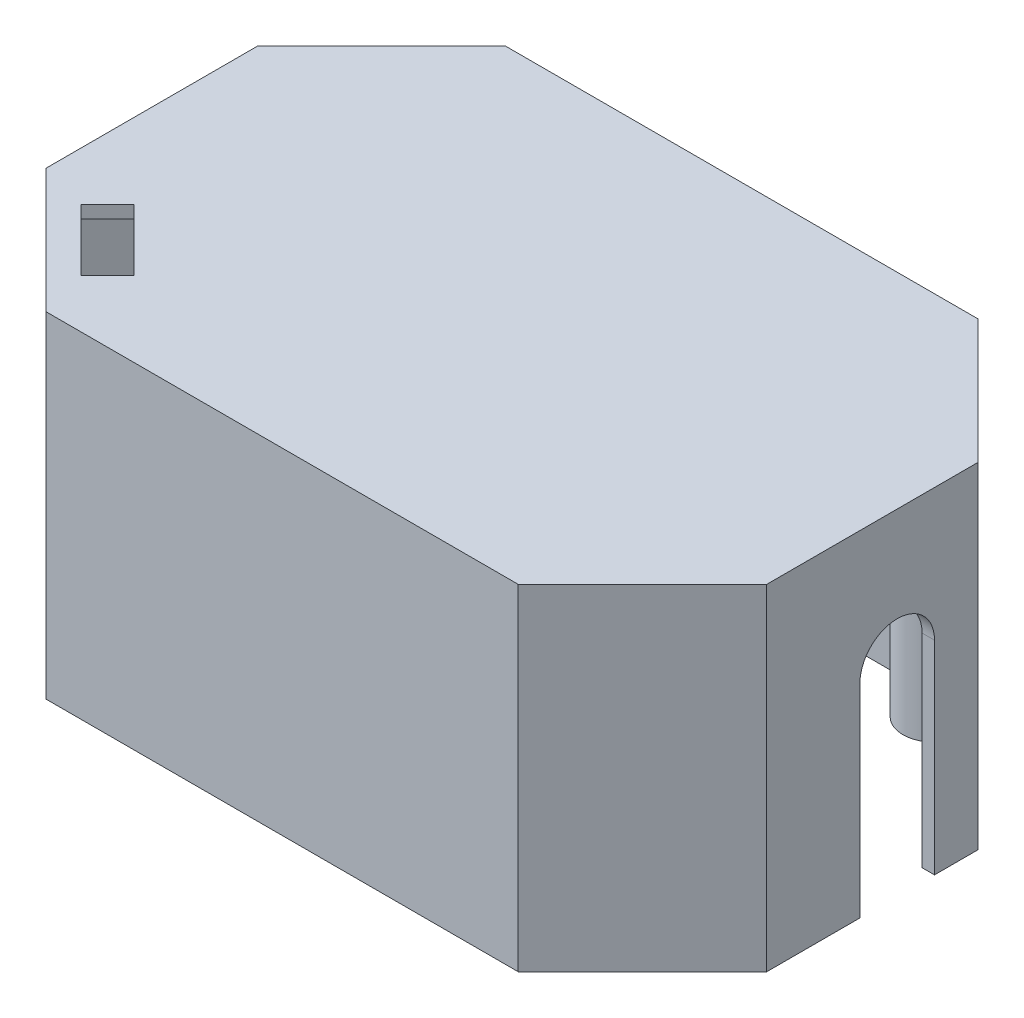
from build123d import *

# Parameters (mm, degrees)
BOSS_EXTRUDE1_DEPTH = 52
BOSS_EXTRUDE2_DEPTH = 2
SKETCH3_R           = 5
BOSS_EXTRUDE3_DEPTH = 52
SKETCH4_R           = 2.5
CUT_EXTRUDE1_DEPTH  = 15
CUT_EXTRUDE2_DEPTH  = 15
CUT_EXTRUDE3_REACH  = 136.539


with BuildPart() as part:
    # Sketch1 → Boss-Extrude1 (new body)
    with BuildSketch(Plane(origin=(0, 0, 0), x_dir=(1, 0, 0), z_dir=(0, 1, 0))):
        Polygon((38, -32.421617333), (-38, -32.421617333), (-58, -12.421649809), (-58, 21.578350191), (-38, 41.578382667), (38, 41.578382667), (58, 21.578415143), (58, -12.421584857), align=None)
        Polygon((-37.171571924, 39.578382667), (-56, 20.749924017), (-56, -11.593221733), (-37.171573826, -30.421617333), (37.171571924, -30.421617333), (56, -11.593158683), (56, 20.749987067), (37.171573826, 39.578382667), align=None, mode=Mode.SUBTRACT)
    extrude(amount=BOSS_EXTRUDE1_DEPTH)

    # Sketch2 → Boss-Extrude2 (add)
    with BuildSketch(Plane(origin=(0, 52, 0), x_dir=(1, 0, 0), z_dir=(0, 1, 0))):
        Polygon((38, -32.421617333), (58, -12.421584857), (58, 21.578415143), (38, 41.578382667), (-38, 41.578382667), (-58, 21.578350191), (-58, -12.421649809), (-38, -32.421617333), align=None)
    extrude(amount=BOSS_EXTRUDE2_DEPTH)

    # Sketch3 → Boss-Extrude3 (add)
    with BuildSketch(Plane.XZ.offset(-52)):
        with Locations((35.928934566, -36.578382667)):
            Circle(SKETCH3_R)
        with Locations((-35.92892981, -36.578382667)):
            Circle(SKETCH3_R)
        with Locations((-35.928934566, 27.421617333)):
            Circle(SKETCH3_R)
        with Locations((35.92892981, 27.421617333)):
            Circle(SKETCH3_R)
    extrude(amount=BOSS_EXTRUDE3_DEPTH)

    # Sketch4 → Cut-Extrude1 (cut)
    with BuildSketch(Plane(origin=(0, 0, 0), x_dir=(-1, 0, 0), z_dir=(0, -1, 0))):
        with Locations(Location((-35.928934566, 36.578382667, 0), (0, 0, 90))):
            Circle(SKETCH4_R)
        with Locations(Location((35.92892981, 36.578382667, 0), (0, 0, 90))):
            Circle(SKETCH4_R)
        with Locations(Location((35.928934566, -27.421617333, 0), (0, 0, 90))):
            Circle(SKETCH4_R)
        with Locations(Location((-35.92892981, -27.421617333, 0), (0, 0, 90))):
            Circle(SKETCH4_R)
    extrude(amount=-CUT_EXTRUDE1_DEPTH, mode=Mode.SUBTRACT)

    # Sketch5 → Cut-Extrude2 (cut)
    with BuildSketch(Plane(origin=(0, 54, 0), x_dir=(1, 0, 0), z_dir=(0, 1, 0))):
        Polygon((-50.121326659, -14.6434607), (-40.221823685, -24.5429476), (-35.979186442, -20.300303468), (-45.878689416, -10.400816569), align=None)
    extrude(amount=-CUT_EXTRUDE2_DEPTH, mode=Mode.SUBTRACT)

    # Cut-Extrude3: up to this face of the body (flat: up to its plane)
    cut_extrude3_end = Plane(part.part.faces().sort_by_distance((58, 27, -4.578415143))[0])
    # Sketch6 → Cut-Extrude3 (cut, up to the picked face)
    with BuildSketch(Plane.ZY.offset(58), mode=Mode.PRIVATE) as cut_extrude3_sk1:
        with BuildLine():
            Line((-14.578350191, 0), (-14.578350191, 32.713069052))
            ThreePointArc((-14.578350191, 32.713069052), (-8.578350191, 38.713069052), (-2.578350191, 32.713069052))
            Line((-2.578350191, 32.713069052), (-2.578350191, 0))
            Line((-2.578350191, 0), (-14.578350191, 0))
        make_face()
    cut_extrude3_tool1 = split(extrude(cut_extrude3_sk1.sketch, amount=-CUT_EXTRUDE3_REACH, mode=Mode.PRIVATE), bisect_by=cut_extrude3_end, keep=Keep.BOTH, mode=Mode.PRIVATE)
    add(cut_extrude3_tool1.solids().sort_by(Axis((-58, 18.736689, -8.57835), (1, 0, 0)))[0], mode=Mode.SUBTRACT)


solid = part.part
